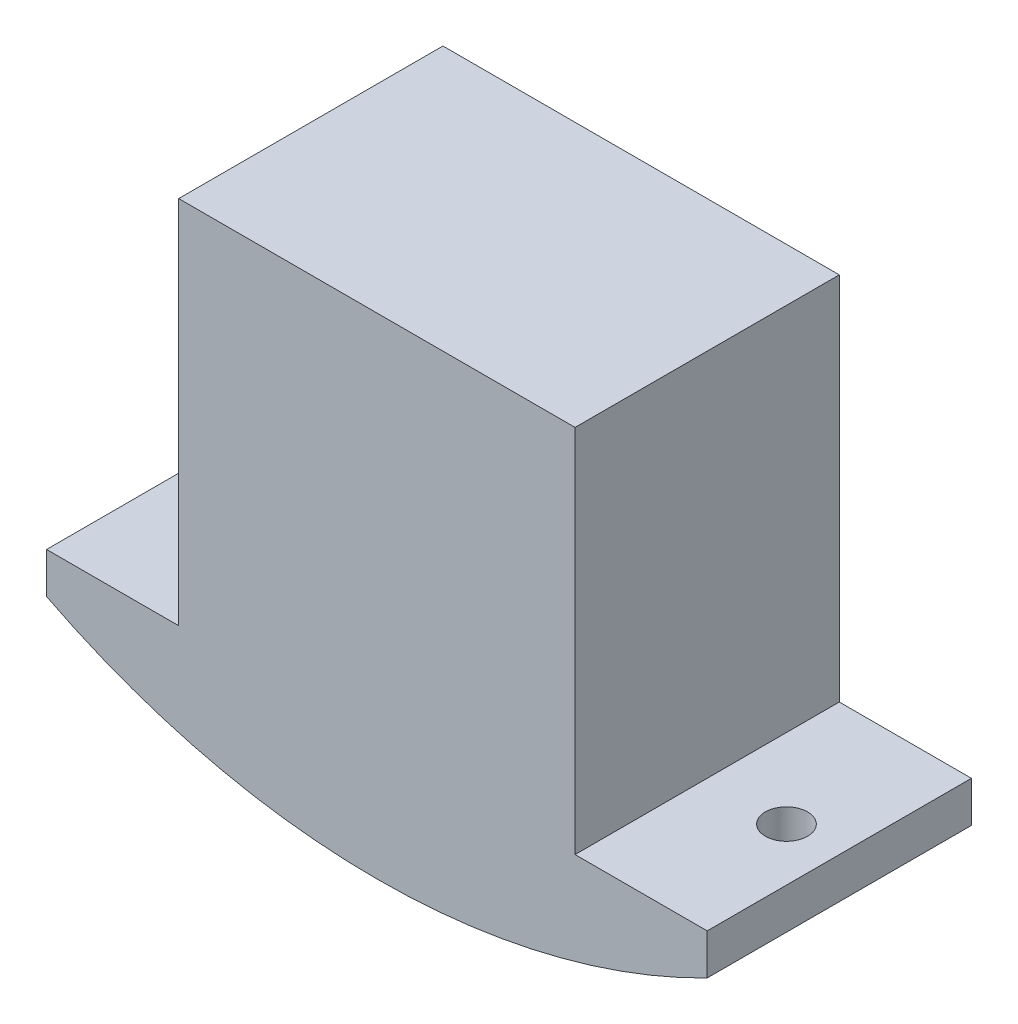
from build123d import *

# Parameters (mm, degrees)
RESSALTO_EXTRUS_O2_DEPTH   = 20
ESBO_O2_R                  = 1.6
CORTE_EXTRUS_O1_DEPTH      = 2.5
CORTE_EXTRUS_O2_REACH      = 46.218
CORTE_EXTRUS_O2_END_RADIUS = 55
ESBO_O3_R                  = 3.1


with BuildPart() as part:
    # Esboço1 → Ressalto-extrusão2 (new body)
    with BuildSketch(Plane.XY):
        with BuildLine():
            Line((-15, -45.899794856), (-15, -17.899794856))
            Line((-15, -17.899794856), (15, -17.899794856))
            Line((15, -17.899794856), (15, -45.899794856))
            Line((15, -45.899794856), (25, -45.899794856))
            Line((25, -45.899794856), (25, -48.989794856))
            ThreePointArc((25, -48.989794856), (0, -55), (-25, -48.989794856))
            Line((-25, -48.989794856), (-25, -45.899794856))
            Line((-25, -45.899794856), (-15, -45.899794856))
        make_face()
    extrude(amount=RESSALTO_EXTRUS_O2_DEPTH)

    # Esboço2 → Corte-extrusão1 (cut)
    with BuildSketch(Plane(origin=(0, -45.899794856, 0), x_dir=(1, 0, 0), z_dir=(0, 1, 0))):
        with Locations(Location((-21, -10, 0), (0, 0, 270))):
            Circle(ESBO_O2_R)
        with Locations(Location((21, -10, 0), (0, 0, 270))):
            Circle(ESBO_O2_R)
    extrude(amount=-CORTE_EXTRUS_O1_DEPTH, mode=Mode.SUBTRACT)

    # Corte-extrusão2: up to this cylinder (the profile starts inside it)
    corte_extrus_o2_end = Plane(origin=(0, 0, 10), z_dir=(0, 0, -1)) * Cylinder(CORTE_EXTRUS_O2_END_RADIUS, 203.436, mode=Mode.PRIVATE)
    # Esboço3 → Corte-extrusão2 (cut, up to the surface)
    with BuildSketch(Plane(origin=(0, -48.399794856, 0), x_dir=(1, 0, 0), z_dir=(0, 1, 0)), mode=Mode.PRIVATE) as corte_extrus_o2_sk1:
        with Locations(Location((-21, -10, 0), (0, 0, 270))):
            Circle(ESBO_O3_R)
    corte_extrus_o2_tool1 = extrude(corte_extrus_o2_sk1.sketch, amount=-CORTE_EXTRUS_O2_REACH, mode=Mode.PRIVATE) & corte_extrus_o2_end
    add(corte_extrus_o2_tool1.solids().sort_by_distance((-21, -48.399795, 10))[0], mode=Mode.SUBTRACT)
    # Esboço3 → Corte-extrusão2 (cut, up to the surface)
    with BuildSketch(Plane(origin=(0, -48.399794856, 0), x_dir=(1, 0, 0), z_dir=(0, 1, 0)), mode=Mode.PRIVATE) as corte_extrus_o2_sk2:
        with Locations(Location((21, -10, 0), (0, 0, 270))):
            Circle(ESBO_O3_R)
    corte_extrus_o2_tool2 = extrude(corte_extrus_o2_sk2.sketch, amount=-CORTE_EXTRUS_O2_REACH, mode=Mode.PRIVATE) & corte_extrus_o2_end
    add(corte_extrus_o2_tool2.solids().sort_by_distance((21, -48.399795, 10))[0], mode=Mode.SUBTRACT)


solid = part.part
